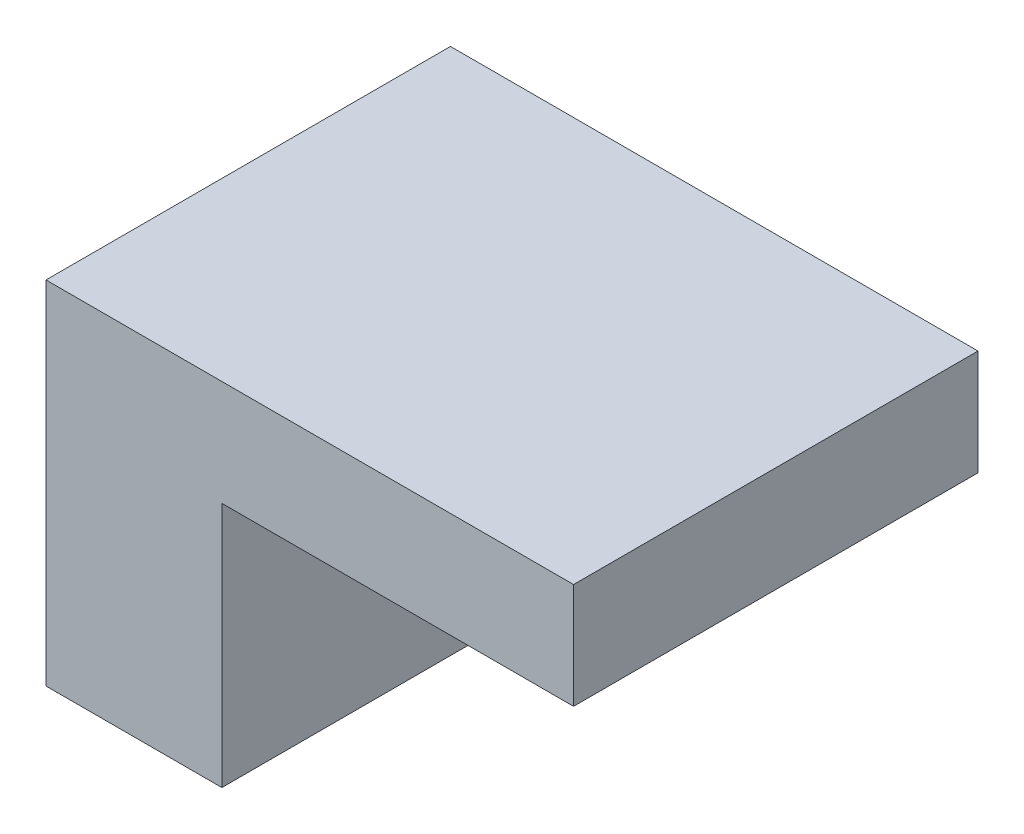
from build123d import *

# Parameters (mm, degrees)
BOSS_EXTRUDE1_DEPTH = 115
RIB1_REACH          = 191.225
SKETCH2_WALL_W      = 510.73669158
SKETCH2_WALL_H      = 10


with BuildPart() as part:
    # Sketch1 → Boss-Extrude1 (new body)
    with BuildSketch(Plane.XY):
        Polygon((0, 0), (0, 100), (150, 100), (150, 70), (50, 70), (50, 0), align=None)
    extrude(amount=BOSS_EXTRUDE1_DEPTH)

    # Sketch2 wall → Rib1 (add, up to next)
    with BuildSketch(Plane(origin=(78.259342081, 44.734908946, 57.5), x_dir=(0.80823649623, 0.588858018679, 0), z_dir=(-0.588858018679, 0.80823649623, 0)), mode=Mode.PRIVATE) as rib1_sk1:
        Rectangle(SKETCH2_WALL_W, SKETCH2_WALL_H)
    rib1_tool1 = extrude(rib1_sk1.sketch, amount=RIB1_REACH, mode=Mode.PRIVATE) - part.part
    add(rib1_tool1.solids().sort_by_distance((78.259342081, 44.734908946, 57.5))[0])


solid = part.part
